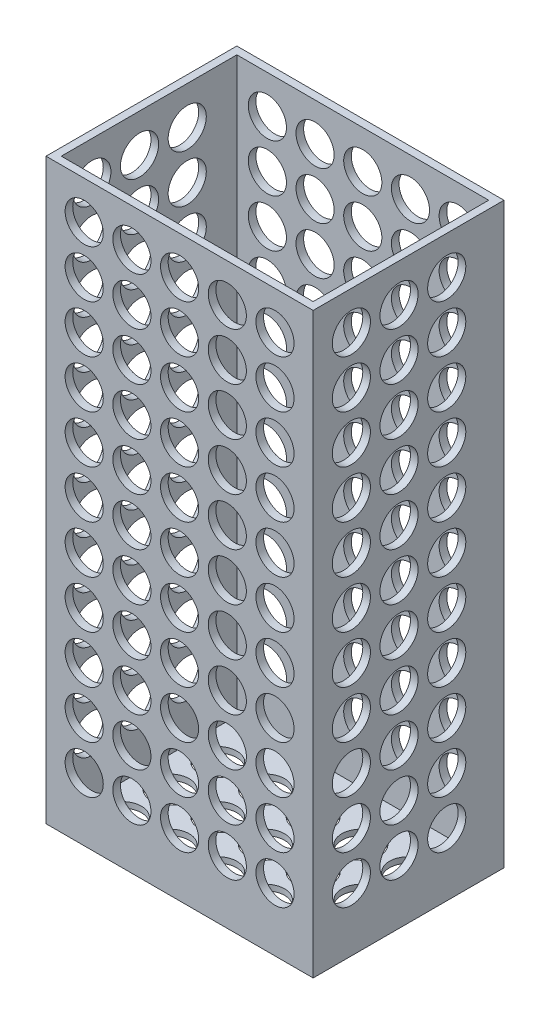
from build123d import *

# Parameters (mm, degrees)
SKETCH1_W           = 70
SKETCH1_H           = 50
BOSS_EXTRUDE1_DEPTH = 1.5
SKETCH2_W           = 70
SKETCH2_H           = 50
SKETCH2_W_2         = 66
SKETCH2_H_2         = 46
BOSS_EXTRUDE2_DEPTH = 150
SKETCH4_R           = 5
CUT_EXTRUDE2_DEPTH  = 150
SKETCH5_R           = 5
CUT_EXTRUDE3_DEPTH  = 150
SKETCH6_R           = 5
CUT_EXTRUDE4_DEPTH  = 150


with BuildPart() as part:
    # Sketch1 → Boss-Extrude1 (new body)
    with BuildSketch(Plane(origin=(0, 0, 0), x_dir=(1, 0, 0), z_dir=(0, 1, 0))):
        Rectangle(SKETCH1_W, SKETCH1_H)
    extrude(amount=BOSS_EXTRUDE1_DEPTH)

    # Sketch2 → Boss-Extrude2 (add)
    with BuildSketch(Plane(origin=(0, 1.5, 0), x_dir=(1, 0, 0), z_dir=(0, 1, 0))):
        Rectangle(SKETCH2_W, SKETCH2_H)
        Rectangle(SKETCH2_W_2, SKETCH2_H_2, mode=Mode.SUBTRACT)
    extrude(amount=BOSS_EXTRUDE2_DEPTH)

    # Sketch4 → Cut-Extrude2 (cut)
    with BuildSketch(Plane.XY.offset(25)):
        with Locations((-25, 141.5)):
            Circle(SKETCH4_R)
        with Locations((-12.5, 141.5)):
            Circle(SKETCH4_R)
        with Locations((0, 141.5)):
            Circle(SKETCH4_R)
        with Locations((12.5, 141.5)):
            Circle(SKETCH4_R)
        with Locations((25, 141.5)):
            Circle(SKETCH4_R)
        with Locations((-12.5, 129)):
            Circle(SKETCH4_R)
        with Locations((0, 129)):
            Circle(SKETCH4_R)
        with Locations((12.5, 129)):
            Circle(SKETCH4_R)
        with Locations((25, 129)):
            Circle(SKETCH4_R)
        with Locations((-12.5, 116.5)):
            Circle(SKETCH4_R)
        with Locations((0, 116.5)):
            Circle(SKETCH4_R)
        with Locations((12.5, 116.5)):
            Circle(SKETCH4_R)
        with Locations((25, 116.5)):
            Circle(SKETCH4_R)
        with Locations((-12.5, 104)):
            Circle(SKETCH4_R)
        with Locations((0, 104)):
            Circle(SKETCH4_R)
        with Locations((12.5, 104)):
            Circle(SKETCH4_R)
        with Locations((25, 104)):
            Circle(SKETCH4_R)
        with Locations((-12.5, 91.5)):
            Circle(SKETCH4_R)
        with Locations((0, 91.5)):
            Circle(SKETCH4_R)
        with Locations((12.5, 91.5)):
            Circle(SKETCH4_R)
        with Locations((25, 91.5)):
            Circle(SKETCH4_R)
        with Locations((-12.5, 79)):
            Circle(SKETCH4_R)
        with Locations((0, 79)):
            Circle(SKETCH4_R)
        with Locations((12.5, 79)):
            Circle(SKETCH4_R)
        with Locations((25, 79)):
            Circle(SKETCH4_R)
        with Locations((-12.5, 66.5)):
            Circle(SKETCH4_R)
        with Locations((0, 66.5)):
            Circle(SKETCH4_R)
        with Locations((12.5, 66.5)):
            Circle(SKETCH4_R)
        with Locations((25, 66.5)):
            Circle(SKETCH4_R)
        with Locations((-12.5, 54)):
            Circle(SKETCH4_R)
        with Locations((0, 54)):
            Circle(SKETCH4_R)
        with Locations((12.5, 54)):
            Circle(SKETCH4_R)
        with Locations((25, 54)):
            Circle(SKETCH4_R)
        with Locations((-12.5, 41.5)):
            Circle(SKETCH4_R)
        with Locations((0, 41.5)):
            Circle(SKETCH4_R)
        with Locations((12.5, 41.5)):
            Circle(SKETCH4_R)
        with Locations((25, 41.5)):
            Circle(SKETCH4_R)
        with Locations((-12.5, 29)):
            Circle(SKETCH4_R)
        with Locations((0, 29)):
            Circle(SKETCH4_R)
        with Locations((12.5, 29)):
            Circle(SKETCH4_R)
        with Locations((25, 29)):
            Circle(SKETCH4_R)
        with Locations((-12.5, 16.5)):
            Circle(SKETCH4_R)
        with Locations((0, 16.5)):
            Circle(SKETCH4_R)
        with Locations((12.5, 16.5)):
            Circle(SKETCH4_R)
        with Locations((25, 16.5)):
            Circle(SKETCH4_R)
        with Locations((-25, 129)):
            Circle(SKETCH4_R)
        with Locations((-25, 116.5)):
            Circle(SKETCH4_R)
        with Locations((-25, 104)):
            Circle(SKETCH4_R)
        with Locations((-25, 91.5)):
            Circle(SKETCH4_R)
        with Locations((-25, 79)):
            Circle(SKETCH4_R)
        with Locations((-25, 66.5)):
            Circle(SKETCH4_R)
        with Locations((-25, 54)):
            Circle(SKETCH4_R)
        with Locations((-25, 41.5)):
            Circle(SKETCH4_R)
        with Locations((-25, 29)):
            Circle(SKETCH4_R)
        with Locations((-25, 16.5)):
            Circle(SKETCH4_R)
    extrude(amount=-CUT_EXTRUDE2_DEPTH, mode=Mode.SUBTRACT)

    # Sketch5 → Cut-Extrude3 (cut)
    with BuildSketch(Plane(origin=(35, 0, 0), x_dir=(0, 0, -1), z_dir=(1, 0, 0))):
        with Locations((-15, 141.5)):
            Circle(SKETCH5_R)
        with Locations((-2.5, 141.5)):
            Circle(SKETCH5_R)
        with Locations((10, 141.5)):
            Circle(SKETCH5_R)
        with Locations((-2.5, 129)):
            Circle(SKETCH5_R)
        with Locations((10, 129)):
            Circle(SKETCH5_R)
        with Locations((-2.5, 116.5)):
            Circle(SKETCH5_R)
        with Locations((10, 116.5)):
            Circle(SKETCH5_R)
        with Locations((-2.5, 104)):
            Circle(SKETCH5_R)
        with Locations((10, 104)):
            Circle(SKETCH5_R)
        with Locations((-2.5, 91.5)):
            Circle(SKETCH5_R)
        with Locations((10, 91.5)):
            Circle(SKETCH5_R)
        with Locations((-2.5, 79)):
            Circle(SKETCH5_R)
        with Locations((10, 79)):
            Circle(SKETCH5_R)
        with Locations((-2.5, 66.5)):
            Circle(SKETCH5_R)
        with Locations((10, 66.5)):
            Circle(SKETCH5_R)
        with Locations((-2.5, 54)):
            Circle(SKETCH5_R)
        with Locations((10, 54)):
            Circle(SKETCH5_R)
        with Locations((-2.5, 41.5)):
            Circle(SKETCH5_R)
        with Locations((10, 41.5)):
            Circle(SKETCH5_R)
        with Locations((-2.5, 29)):
            Circle(SKETCH5_R)
        with Locations((10, 29)):
            Circle(SKETCH5_R)
        with Locations((-2.5, 16.5)):
            Circle(SKETCH5_R)
        with Locations((10, 16.5)):
            Circle(SKETCH5_R)
        with Locations((-15, 129)):
            Circle(SKETCH5_R)
        with Locations((-15, 116.5)):
            Circle(SKETCH5_R)
        with Locations((-15, 104)):
            Circle(SKETCH5_R)
        with Locations((-15, 91.5)):
            Circle(SKETCH5_R)
        with Locations((-15, 79)):
            Circle(SKETCH5_R)
        with Locations((-15, 66.5)):
            Circle(SKETCH5_R)
        with Locations((-15, 54)):
            Circle(SKETCH5_R)
        with Locations((-15, 41.5)):
            Circle(SKETCH5_R)
        with Locations((-15, 29)):
            Circle(SKETCH5_R)
        with Locations((-15, 16.5)):
            Circle(SKETCH5_R)
    extrude(amount=-CUT_EXTRUDE3_DEPTH, mode=Mode.SUBTRACT)

    # Sketch6 → Cut-Extrude4 (cut)
    with BuildSketch(Plane.XZ):
        with Locations(Location((25, 15, 0), (0, 0, 270))):
            Circle(SKETCH6_R)
        with Locations(Location((12.5, 15, 0), (0, 0, 270))):
            Circle(SKETCH6_R)
        with Locations(Location((0, 15, 0), (0, 0, 270))):
            Circle(SKETCH6_R)
        with Locations(Location((-12.5, 15, 0), (0, 0, 270))):
            Circle(SKETCH6_R)
        with Locations(Location((-25, 15, 0), (0, 0, 270))):
            Circle(SKETCH6_R)
        with Locations(Location((12.5, 2.5, 0), (0, 0, 270))):
            Circle(SKETCH6_R)
        with Locations(Location((0, 2.5, 0), (0, 0, 270))):
            Circle(SKETCH6_R)
        with Locations(Location((-12.5, 2.5, 0), (0, 0, 270))):
            Circle(SKETCH6_R)
        with Locations(Location((-25, 2.5, 0), (0, 0, 270))):
            Circle(SKETCH6_R)
        with Locations(Location((12.5, -10, 0), (0, 0, 270))):
            Circle(SKETCH6_R)
        with Locations(Location((0, -10, 0), (0, 0, 270))):
            Circle(SKETCH6_R)
        with Locations(Location((-12.5, -10, 0), (0, 0, 270))):
            Circle(SKETCH6_R)
        with Locations(Location((-25, -10, 0), (0, 0, 270))):
            Circle(SKETCH6_R)
        with Locations(Location((25, 2.5, 0), (0, 0, 270))):
            Circle(SKETCH6_R)
        with Locations(Location((25, -10, 0), (0, 0, 270))):
            Circle(SKETCH6_R)
    extrude(amount=-CUT_EXTRUDE4_DEPTH, mode=Mode.SUBTRACT)


solid = part.part
